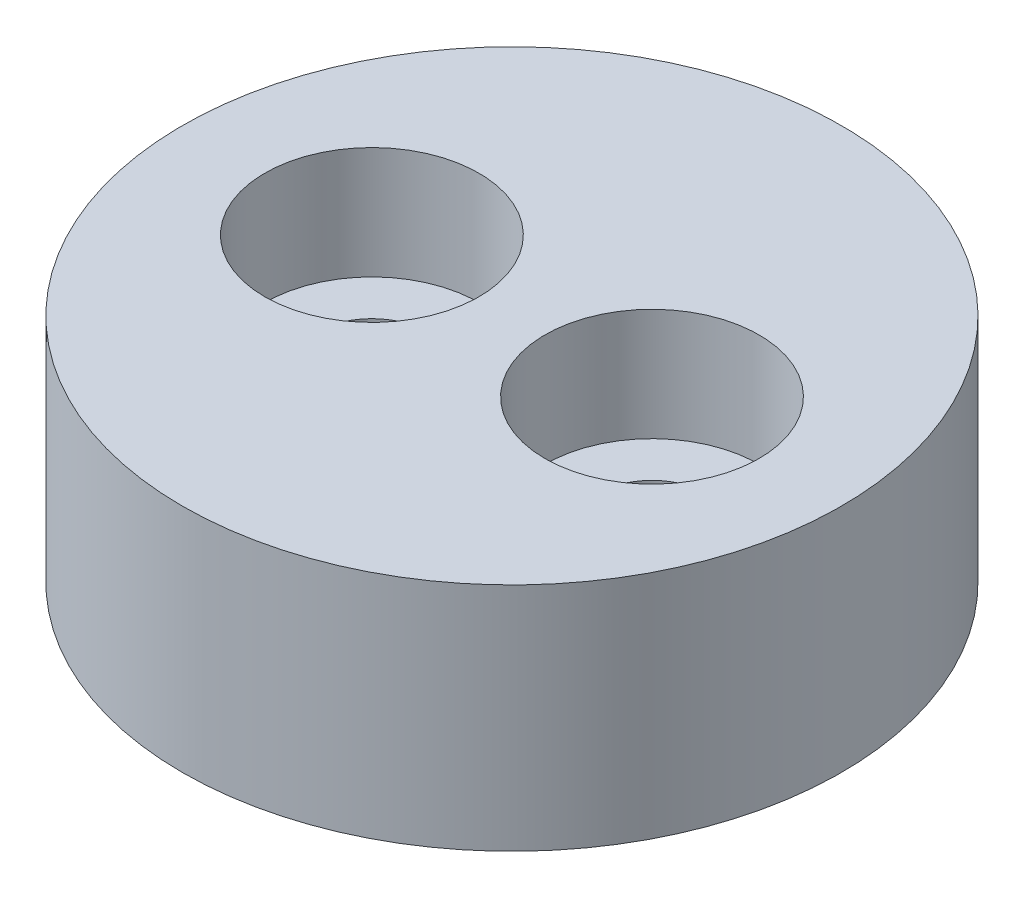
from build123d import *

# Parameters (mm, degrees)
SKIZZE1_R                                            = 10
AUFSATZ_LINEAR_AUSTRAGEN1_DEPTH                      = 7
STIRNSENKUNG_F_R_M3_ZYLINDERSCHRAUBE_MIT_D           = 3.4
STIRNSENKUNG_F_R_M3_ZYLINDERSCHRAUBE_MIT_CBORE_D     = 6.5
STIRNSENKUNG_F_R_M3_ZYLINDERSCHRAUBE_MIT_CBORE_DEPTH = 3.4


with BuildPart() as part:
    # Skizze1 → Aufsatz-Linear austragen1 (new body)
    with BuildSketch(Plane(origin=(0, 0, 0), x_dir=(1, 0, 0), z_dir=(0, 1, 0))):
        with Locations(Location((0, 0, 0), (0, 0, 270))):
            Circle(SKIZZE1_R)
    extrude(amount=AUFSATZ_LINEAR_AUSTRAGEN1_DEPTH)

    # Stirnsenkung für M3 Zylinderschraube mit Innensechskant1 (through all)
    with Locations(Plane(origin=(0, 7, 0), x_dir=(1, 0, 0), z_dir=(0, 1, 0))):
        with Locations((4.25, 0), (-4.25, 0)):
            CounterBoreHole(STIRNSENKUNG_F_R_M3_ZYLINDERSCHRAUBE_MIT_D / 2, STIRNSENKUNG_F_R_M3_ZYLINDERSCHRAUBE_MIT_CBORE_D / 2, STIRNSENKUNG_F_R_M3_ZYLINDERSCHRAUBE_MIT_CBORE_DEPTH)


solid = part.part
